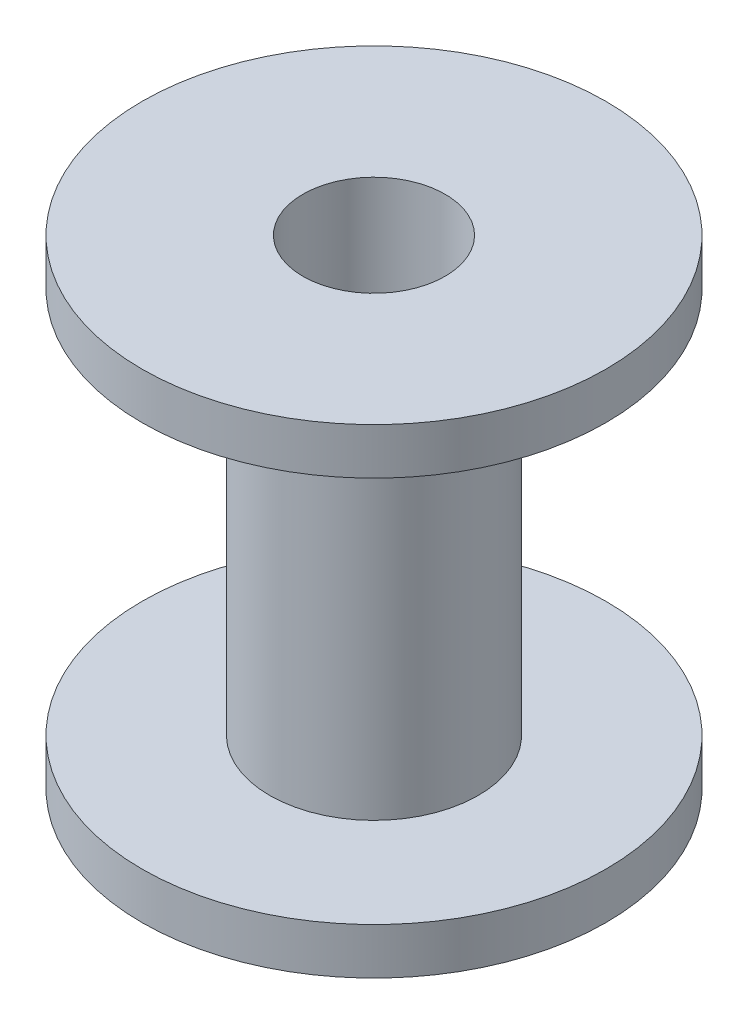
from build123d import *


with BuildPart() as part:
    # Sketch2 → Revolve1 (revolve)
    with BuildSketch(Plane(origin=(0, 0, 0), x_dir=(0, 0, -1), z_dir=(1, 0, 0))):
        Polygon((-15, 15.5), (-15, 12.5), (-6.75, 12.5), (-6.75, -12.5), (-15, -12.5), (-15, -15.5), (-4.6, -15.5), (-4.6, 15.5), align=None)
    revolve(axis=Axis((0, 15.5, 0), (0, -1, 0)))


solid = part.part
